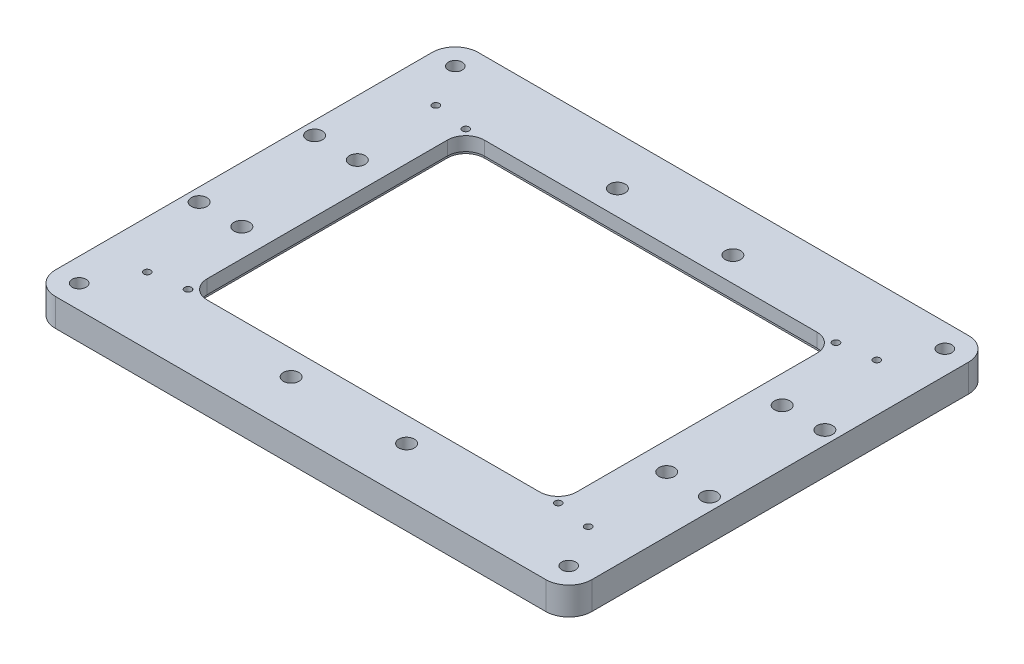
from build123d import *

# Parameters (mm, degrees)
SKETCH_2_W               = 220
SKETCH_2_H               = 150
SKETCH_2_W_2             = 160
SKETCH_2_H_2             = 120
EXTRUDE_1_DEPTH          = 12
SKETCH_3_W               = 170.5
SKETCH_3_H               = 130.5
CUT_EXTRUDE_1_DEPTH      = 6
FILLET_1_R               = 8
FILLET_2_R               = 8
FILLET_3_R               = 8
CUT_EXTRUDE_2_DEPTH      = 134.270401815
CUT_EXTRUDE_2_DEPTH_BACK = 140.270401815
CUT_EXTRUDE_2_START      = 6
SKETCH_4_R               = 1.5
SKETCH_6_W               = 241.523327546
SKETCH_6_H               = 183.41982478
SKETCH_6_W_2             = 210.674446864
SKETCH_6_H_2             = 143.430858526
EXTRUDE_2_DEPTH          = 12
SKETCH_5_R               = 3.3655
CUT_EXTRUDE_3_DEPTH      = 22
SKETCH_7_R               = 3
CUT_EXTRUDE_4_DEPTH      = 22
FILLET_4_R               = 6
FILLET_5_R               = 6
FILLET_6_R               = 6
FILLET_7_R               = 6
SKETCH_14_W              = 180
SKETCH_14_H              = 7.031256172
SKETCH_14_R              = 2
EXTRUDE_3_DEPTH          = 12
SKETCH_14_W_2            = 130
SKETCH_14_H_2            = 7
EXTRUDE_3_2_DEPTH        = 12
EXTRUDE_3_3_DEPTH        = 12
EXTRUDE_3_4_DEPTH        = 12
SKETCH_15_W              = 460.716543434
SKETCH_15_H              = 403.643057854
SKETCH_15_W_2            = 232.32954725
SKETCH_15_H_2            = 183.087092282
CUT_EXTRUDE_8_DEPTH      = 105
FILLET_8_R               = 10


with BuildPart() as part:
    # Эскиз2 → Бобышка-Вытянуть1 (new body)
    with BuildSketch(Plane(origin=(0, 0, 0), x_dir=(1, 0, 0), z_dir=(0, 1, 0))):
        Rectangle(SKETCH_2_W, SKETCH_2_H)
        Rectangle(SKETCH_2_W_2, SKETCH_2_H_2, mode=Mode.SUBTRACT)
    extrude(amount=EXTRUDE_1_DEPTH)

    # Эскиз3 → Вырез-Вытянуть1 (cut)
    with BuildSketch(Plane.XZ):
        Rectangle(SKETCH_3_W, SKETCH_3_H)
    extrude(amount=-CUT_EXTRUDE_1_DEPTH, mode=Mode.SUBTRACT)

    # Скругление1
    fillet_1_edges = [part.edges().sort_by_distance(p)[0] for p in [
        (80, 9, 60),
    ]]
    fillet(fillet_1_edges, radius=FILLET_1_R)

    # Скругление2
    fillet_2_edges = [part.edges().sort_by_distance(p)[0] for p in [
        (85.25, 3, 65.25),
    ]]
    fillet(fillet_2_edges, radius=FILLET_2_R)

    # Скругление3
    fillet_3_edges = [part.edges().sort_by_distance(p)[0] for p in [
        (80, 9, -60),
        (-80, 9, -60),
        (-80, 9, 60),
        (85.25, 3, -65.25),
        (-85.25, 3, -65.25),
        (-85.25, 3, 65.25),
    ]]
    fillet(fillet_3_edges, radius=FILLET_3_R)

    # Эскиз4 → Вырез-Вытянуть2 (cut, two sides: drawn at the far end of the back side and taken through both)
    with BuildSketch(Plane.XZ.offset(-6).offset(CUT_EXTRUDE_2_START - CUT_EXTRUDE_2_DEPTH_BACK)):
        with Locations(Location((-80.15, 60.15, 0), (0, 0, 270))):
            Circle(SKETCH_4_R)
        with Locations(Location((-80.15, -60.15, 0), (0, 0, 270))):
            Circle(SKETCH_4_R)
        with Locations(Location((80.15, -60.15, 0), (0, 0, 270))):
            Circle(SKETCH_4_R)
        with Locations(Location((80.15, 60.15, 0), (0, 0, 270))):
            Circle(SKETCH_4_R)
        with Locations(Location((-95.5, 62.5, 0), (0, 0, 270))):
            Circle(SKETCH_4_R)
        with Locations(Location((-95.5, -62.5, 0), (0, 0, 270))):
            Circle(SKETCH_4_R)
        with Locations(Location((95.5, -62.5, 0), (0, 0, 270))):
            Circle(SKETCH_4_R)
        with Locations(Location((95.5, 62.5, 0), (0, 0, 270))):
            Circle(SKETCH_4_R)
    extrude(amount=CUT_EXTRUDE_2_DEPTH + CUT_EXTRUDE_2_DEPTH_BACK, mode=Mode.SUBTRACT)

    # Эскиз6 → Бобышка-Вытянуть2 (add)
    with BuildSketch(Plane.XZ):
        Rectangle(SKETCH_6_W, SKETCH_6_H)
        Rectangle(SKETCH_6_W_2, SKETCH_6_H_2, mode=Mode.SUBTRACT)
    extrude(amount=-EXTRUDE_2_DEPTH)

    # Эскиз5 → Вырез-Вытянуть3 (cut)
    with BuildSketch(Plane.XZ):
        with Locations(Location((-92.006407499, -25, 0), (0, 0, 270))):
            Circle(SKETCH_5_R)
        with Locations(Location((-110.497607499, -25, 0), (0, 0, 270))):
            Circle(SKETCH_5_R)
        with Locations(Location((-110.497607499, 25.000000038, 0), (0, 0, 270))):
            Circle(SKETCH_5_R)
        with Locations(Location((-92.006407499, 25.000000038, 0), (0, 0, 270))):
            Circle(SKETCH_5_R)
        with Locations(Location((92.006407499, 25.000000038, 0), (0, 0, 270))):
            Circle(SKETCH_5_R)
        with Locations(Location((110.497607499, 25.000000038, 0), (0, 0, 270))):
            Circle(SKETCH_5_R)
        with Locations(Location((110.497607499, -25, 0), (0, 0, 270))):
            Circle(SKETCH_5_R)
        with Locations(Location((92.006407499, -25, 0), (0, 0, 270))):
            Circle(SKETCH_5_R)
        with Locations(Location((25, 70.661122045, 0), (0, 0, 270))):
            Circle(SKETCH_5_R)
        with Locations(Location((-25.000000038, 70.661122045, 0), (0, 0, 270))):
            Circle(SKETCH_5_R)
        with Locations(Location((-25.000000038, -70.661122045, 0), (0, 0, 270))):
            Circle(SKETCH_5_R)
        with Locations(Location((25, -70.661122045, 0), (0, 0, 270))):
            Circle(SKETCH_5_R)
    extrude(amount=-CUT_EXTRUDE_3_DEPTH, mode=Mode.SUBTRACT)

    # Эскиз7 → Вырез-Вытянуть4 (cut)
    with BuildSketch(Plane.XZ):
        with Locations(Location((-106.020205838, -81.450824183, 0), (0, 0, 270))):
            Circle(SKETCH_7_R)
        with Locations(Location((-106.020205838, 81.450824183, 0), (0, 0, 270))):
            Circle(SKETCH_7_R)
        with Locations(Location((106.020205838, 81.450824183, 0), (0, 0, 270))):
            Circle(SKETCH_7_R)
        with Locations(Location((106.020205838, -81.450824183, 0), (0, 0, 270))):
            Circle(SKETCH_7_R)
    extrude(amount=-CUT_EXTRUDE_4_DEPTH, mode=Mode.SUBTRACT)

    # Скругление4
    fillet_4_edges = [part.edges().sort_by_distance(p)[0] for p in [
        (120.761663773, 6, 91.70991239),
    ]]
    fillet(fillet_4_edges, radius=FILLET_4_R)

    # Скругление5
    fillet_5_edges = [part.edges().sort_by_distance(p)[0] for p in [
        (120.761663773, 6, -91.70991239),
    ]]
    fillet(fillet_5_edges, radius=FILLET_5_R)

    # Скругление6
    fillet_6_edges = [part.edges().sort_by_distance(p)[0] for p in [
        (-120.761663773, 6, -91.70991239),
    ]]
    fillet(fillet_6_edges, radius=FILLET_6_R)

    # Скругление7
    fillet_7_edges = [part.edges().sort_by_distance(p)[0] for p in [
        (-120.761663773, 6, 91.70991239),
    ]]
    fillet(fillet_7_edges, radius=FILLET_7_R)


with BuildPart() as body_2:
    # Эскиз14 → Бобышка-Вытянуть3 (new body)
    with BuildSketch(Plane(origin=(0, 12, 0), x_dir=(1, 0, 0), z_dir=(0, 1, 0))):
        with Locations((1.41446019, 109.44602362)):
            Rectangle(SKETCH_14_W, SKETCH_14_H)
        with Locations(Location((-81.58561634, 109.413291168, 0), (0, 0, 270))):
            Circle(SKETCH_14_R, mode=Mode.SUBTRACT)
        with Locations(Location((1.41446019, 109.413291168, 0), (0, 0, 270))):
            Circle(SKETCH_14_R, mode=Mode.SUBTRACT)
        with Locations(Location((84.41453672, 109.413291168, 0), (0, 0, 270))):
            Circle(SKETCH_14_R, mode=Mode.SUBTRACT)
    extrude(amount=-EXTRUDE_3_DEPTH)


with BuildPart() as body_3:
    # Эскиз14 → Extrude 3 2 (new body)
    with BuildSketch(Plane(origin=(0, 12, 0), x_dir=(1, 0, 0), z_dir=(0, 1, 0))):
        with Locations((-6.451217143, 118.582116541)):
            Rectangle(SKETCH_14_W_2, SKETCH_14_H_2)
        with Locations(Location((51.548782857, 118.582116541, 0), (0, 0, 270))):
            Circle(SKETCH_14_R, mode=Mode.SUBTRACT)
        with Locations(Location((-6.451217143, 118.582116541, 0), (0, 0, 270))):
            Circle(SKETCH_14_R, mode=Mode.SUBTRACT)
        with Locations(Location((-64.451217143, 118.582116541, 0), (0, 0, 270))):
            Circle(SKETCH_14_R, mode=Mode.SUBTRACT)
    extrude(amount=-EXTRUDE_3_2_DEPTH)


with BuildPart() as body_4:
    # Эскиз14 → Extrude 3 3 (new body)
    with BuildSketch(Plane(origin=(0, 12, 0), x_dir=(1, 0, 0), z_dir=(0, 1, 0))):
        with Locations((1.538593971, 129.106977772)):
            Rectangle(SKETCH_14_W, SKETCH_14_H)
        with Locations(Location((-81.461482559, 129.07424532, 0), (0, 0, 270))):
            Circle(SKETCH_14_R, mode=Mode.SUBTRACT)
        with Locations(Location((1.538593971, 129.07424532, 0), (0, 0, 270))):
            Circle(SKETCH_14_R, mode=Mode.SUBTRACT)
        with Locations(Location((84.538670501, 129.07424532, 0), (0, 0, 270))):
            Circle(SKETCH_14_R, mode=Mode.SUBTRACT)
    extrude(amount=-EXTRUDE_3_3_DEPTH)


with BuildPart() as body_5:
    # Эскиз14 → Extrude 3 4 (new body)
    with BuildSketch(Plane(origin=(0, 12, 0), x_dir=(1, 0, 0), z_dir=(0, 1, 0))):
        with Locations((-6.327083362, 138.243070693)):
            Rectangle(SKETCH_14_W_2, SKETCH_14_H_2)
        with Locations(Location((51.672916638, 138.243070693, 0), (0, 0, 270))):
            Circle(SKETCH_14_R, mode=Mode.SUBTRACT)
        with Locations(Location((-6.327083362, 138.243070693, 0), (0, 0, 270))):
            Circle(SKETCH_14_R, mode=Mode.SUBTRACT)
        with Locations(Location((-64.327083362, 138.243070693, 0), (0, 0, 270))):
            Circle(SKETCH_14_R, mode=Mode.SUBTRACT)
    extrude(amount=-EXTRUDE_3_4_DEPTH)


with BuildPart() as cut_extrude_8_tool:
    # Эскиз15 → Вырез-Вытянуть8 (new body)
    with BuildSketch(Plane.XZ):
        Rectangle(SKETCH_15_W, SKETCH_15_H)
        Rectangle(SKETCH_15_W_2, SKETCH_15_H_2, mode=Mode.SUBTRACT)
    extrude(amount=-CUT_EXTRUDE_8_DEPTH)


with BuildPart() as part_1:
    add(part.part)

    # Вырез-Вытянуть8: cut by cut_extrude_8_tool
    add(cut_extrude_8_tool.part, mode=Mode.SUBTRACT)

    # Скругление8
    fillet_8_edges = [part_1.edges().sort_by_distance(p)[0] for p in [
        (116.164773625, 6, -91.543546141),
        (-116.164773625, 6, -91.543546141),
        (-116.164773625, 6, 91.543546141),
        (116.164773625, 6, 91.543546141),
    ]]
    fillet(fillet_8_edges, radius=FILLET_8_R)


with BuildPart() as body_2_1:
    add(body_2.part)

    # Вырез-Вытянуть8: cut by cut_extrude_8_tool
    add(cut_extrude_8_tool.part, mode=Mode.SUBTRACT)


with BuildPart() as body_3_1:
    add(body_3.part)

    # Вырез-Вытянуть8: cut by cut_extrude_8_tool
    add(cut_extrude_8_tool.part, mode=Mode.SUBTRACT)


with BuildPart() as body_4_1:
    add(body_4.part)

    # Вырез-Вытянуть8: cut by cut_extrude_8_tool
    add(cut_extrude_8_tool.part, mode=Mode.SUBTRACT)


with BuildPart() as body_5_1:
    add(body_5.part)

    # Вырез-Вытянуть8: cut by cut_extrude_8_tool
    add(cut_extrude_8_tool.part, mode=Mode.SUBTRACT)


solid = part_1.part
